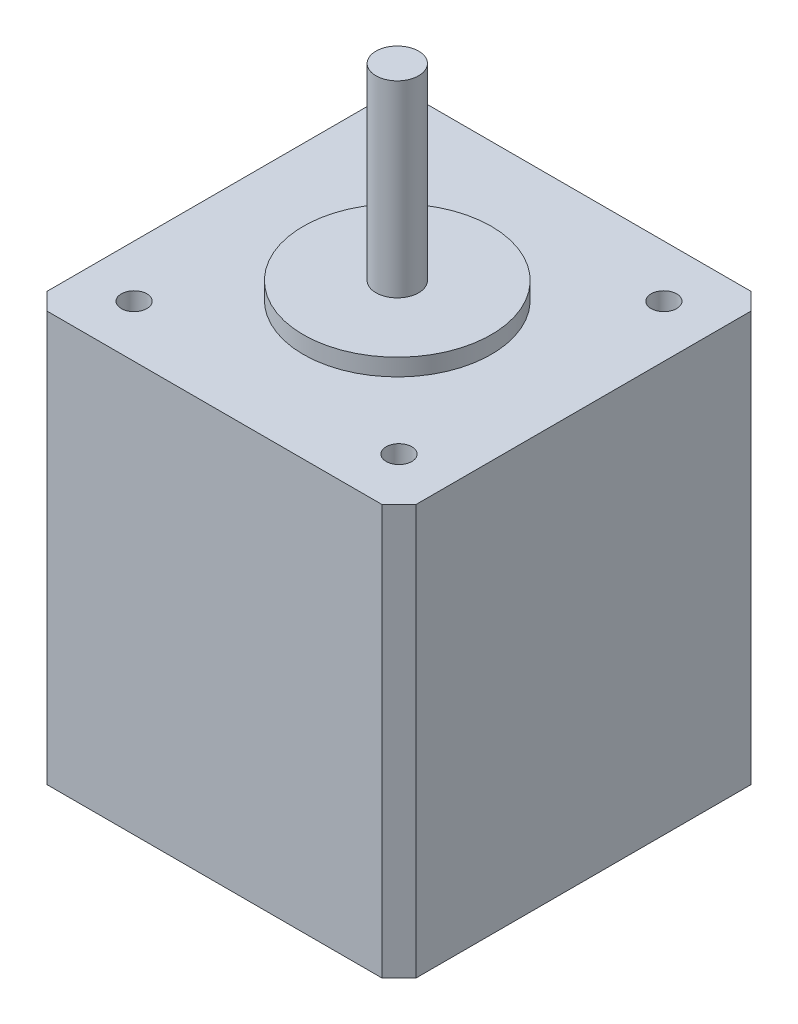
from build123d import *

# Parameters (mm, degrees)
SKETCH1_W           = 43.2
SKETCH1_H           = 43.2
SKETCH1_R           = 1.5
BOSS_EXTRUDE1_DEPTH = 48
CHAMFER1_SIZE       = 2
SKETCH2_R           = 11
BOSS_EXTRUDE2_DEPTH = 2
SKETCH3_R           = 2.5
BOSS_EXTRUDE3_DEPTH = 24


with BuildPart() as part:
    # Sketch1 → Boss-Extrude1 (new body)
    with BuildSketch(Plane(origin=(0, 0, 0), x_dir=(1, 0, 0), z_dir=(0, 1, 0))):
        with Locations((21.6, 21.6)):
            Rectangle(SKETCH1_W, SKETCH1_H)
        with Locations(Location((6.1, 37.1, 0), (0, 0, 270))):
            Circle(SKETCH1_R, mode=Mode.SUBTRACT)
        with Locations(Location((37.1, 37.1, 0), (0, 0, 270))):
            Circle(SKETCH1_R, mode=Mode.SUBTRACT)
        with Locations(Location((37.1, 6.1, 0), (0, 0, 270))):
            Circle(SKETCH1_R, mode=Mode.SUBTRACT)
        with Locations(Location((6.1, 6.1, 0), (0, 0, 270))):
            Circle(SKETCH1_R, mode=Mode.SUBTRACT)
    extrude(amount=BOSS_EXTRUDE1_DEPTH)

    # Chamfer1
    chamfer1_edges = [part.edges().sort_by_distance(p)[0] for p in [
        (0, 24, -43.2),
        (43.2, 24, -43.2),
        (43.2, 24, 0),
        (0, 24, 0),
    ]]
    chamfer(chamfer1_edges, length=CHAMFER1_SIZE)

    # Sketch2 → Boss-Extrude2 (add)
    with BuildSketch(Plane(origin=(0, 48, 0), x_dir=(1, 0, 0), z_dir=(0, 1, 0))):
        with Locations(Location((21.4, 21.6, 0), (0, 0, 90))):
            Circle(SKETCH2_R)
    extrude(amount=BOSS_EXTRUDE2_DEPTH)

    # Sketch3 → Boss-Extrude3 (add)
    with BuildSketch(Plane(origin=(0, 48, 0), x_dir=(1, 0, 0), z_dir=(0, 1, 0))):
        with Locations(Location((21.4, 21.6, 0), (0, 0, 270))):
            Circle(SKETCH3_R)
    extrude(amount=BOSS_EXTRUDE3_DEPTH)


solid = part.part
